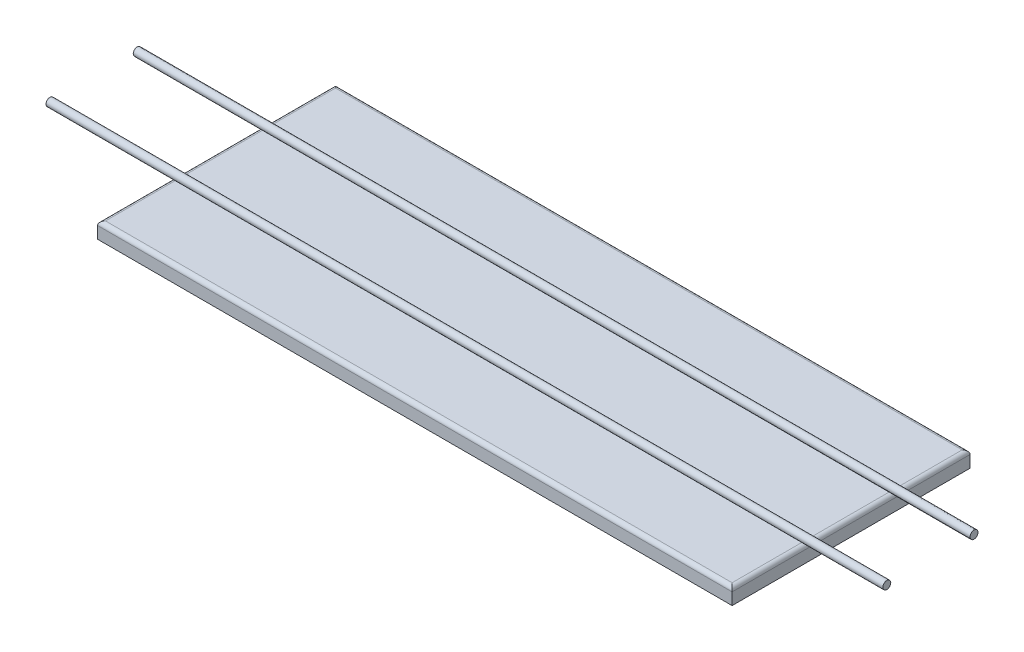
from build123d import *

# Parameters (mm, degrees)
CROQUIS1_W            = 800
CROQUIS1_H            = 300
EXTRUIR1_DEPTH        = 20
REDONDEO1_R           = 5
EXTRUIR2_DEPTH        = 500
EXTRUIR2_DEPTH_BACK   = 555
CROQUIS2_R            = 5
EXTRUIR2_2_DEPTH      = 500
EXTRUIR2_2_DEPTH_BACK = 555


with BuildPart() as part:
    # Croquis1 → Extruir1 (new body)
    with BuildSketch(Plane(origin=(0, 0, 0), x_dir=(1, 0, 0), z_dir=(0, 1, 0))):
        Rectangle(CROQUIS1_W, CROQUIS1_H)
    extrude(amount=EXTRUIR1_DEPTH)

    # Redondeo1
    redondeo1_edges = [part.edges().sort_by_distance(p)[0] for p in [
        (400, 20, 0),
        (0, 20, -150),
        (-400, 20, 0),
        (0, 20, 150),
    ]]
    fillet(redondeo1_edges, radius=REDONDEO1_R)


with BuildPart() as body_2:
    # Croquis2 → Extruir2 (new, two sides: drawn at the far end of the back side and taken through both)
    with BuildSketch(Plane(origin=(0, 0, 0), x_dir=(0, 0, -1), z_dir=(1, 0, 0)).offset(-EXTRUIR2_DEPTH_BACK)):
        with Locations((-55, 25)):
            Circle(CROQUIS2_R)
    extrude(amount=EXTRUIR2_DEPTH + EXTRUIR2_DEPTH_BACK)


with BuildPart() as body_3:
    # Croquis2 → Extruir2 2 (new, two sides: drawn at the far end of the back side and taken through both)
    with BuildSketch(Plane(origin=(0, 0, 0), x_dir=(0, 0, -1), z_dir=(1, 0, 0)).offset(-EXTRUIR2_2_DEPTH_BACK)):
        with Locations(Location((55, 25, 0), (0, 0, 180))):
            Circle(CROQUIS2_R)
    extrude(amount=EXTRUIR2_2_DEPTH + EXTRUIR2_2_DEPTH_BACK)


solid = Compound([part.part, body_2.part, body_3.part])
